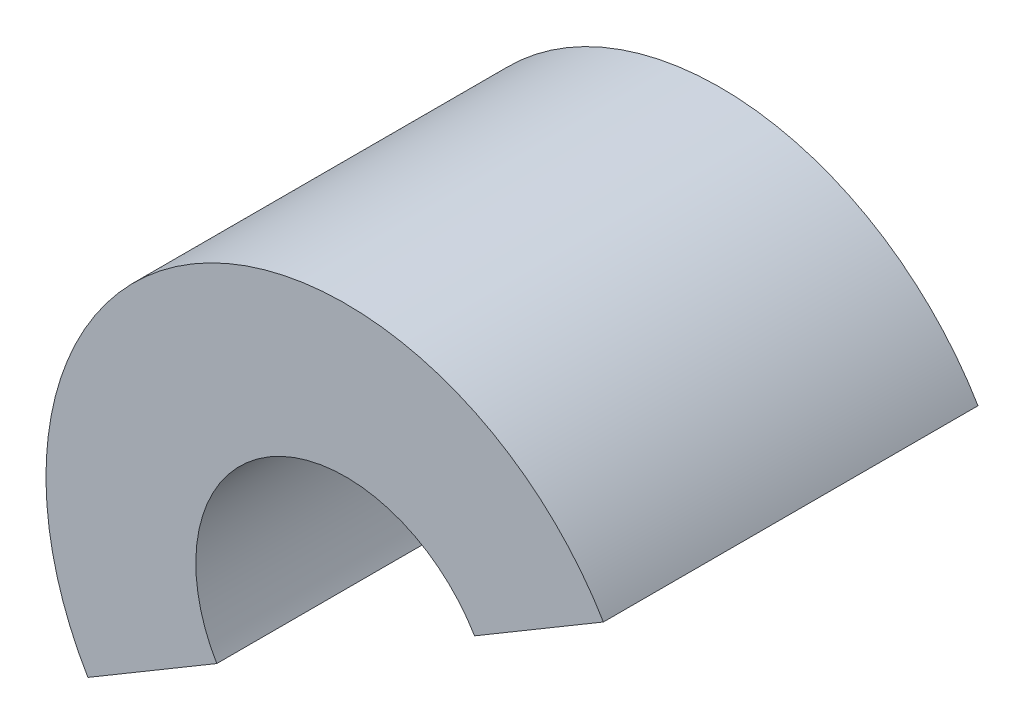
from build123d import *

# Parameters (mm, degrees)
BOSS_EXTRUDE1_DEPTH = 25


with BuildPart() as part:
    # Sketch1 → Boss-Extrude1 (new body)
    with BuildSketch(Plane.XY):
        with BuildLine():
            ThreePointArc((17.20214094, 10.202271663), (-10.202271663, 17.20214094), (-17.20214094, -10.202271663))
            Line((-17.20214094, -10.202271663), (-8.60107047, -5.101135832))
            ThreePointArc((-8.60107047, -5.101135832), (-5.101135832, 8.60107047), (8.60107047, 5.101135832))
            Line((8.60107047, 5.101135832), (17.20214094, 10.202271663))
        make_face()
    extrude(amount=BOSS_EXTRUDE1_DEPTH)


solid = part.part
